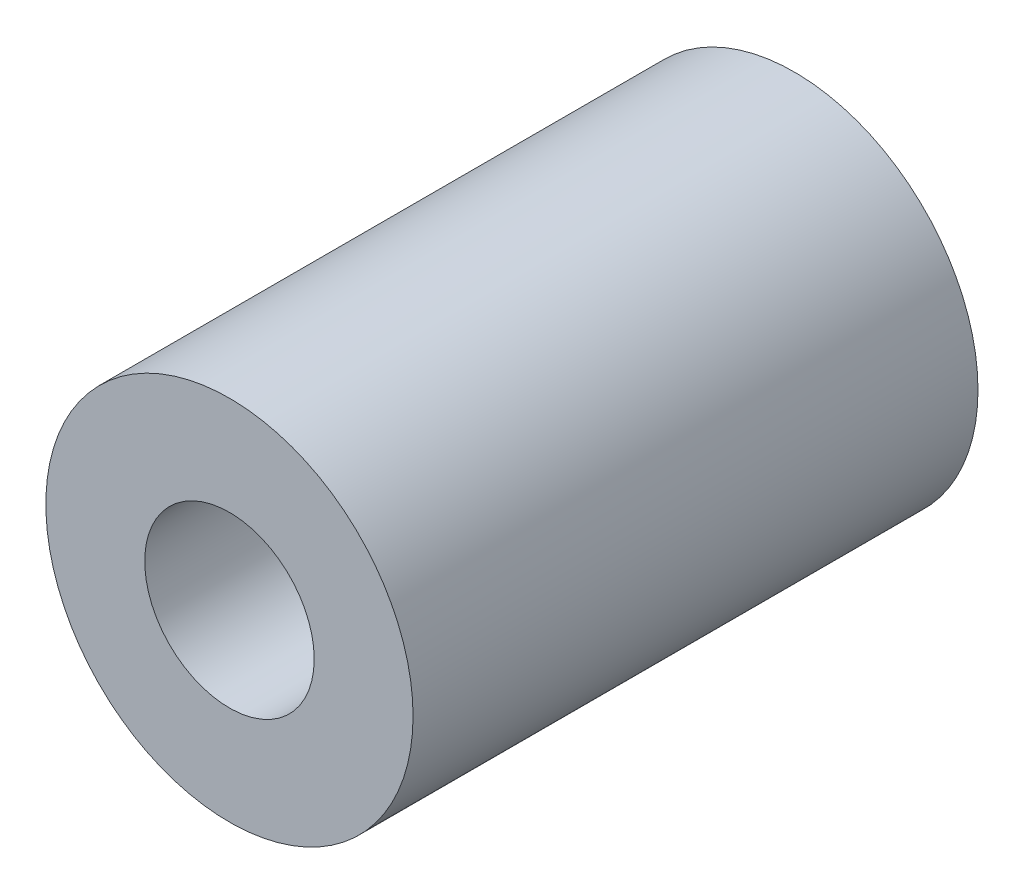
from build123d import *

# Parameters (mm, degrees)
SKETCH1_R           = 6.5
SKETCH1_R_2         = 3
BOSS_EXTRUDE3_DEPTH = 20


with BuildPart() as part:
    # Sketch1 → Boss-Extrude3 (new body)
    with BuildSketch(Plane.XY):
        Circle(SKETCH1_R)
        Circle(SKETCH1_R_2, mode=Mode.SUBTRACT)
    extrude(amount=BOSS_EXTRUDE3_DEPTH)


solid = part.part
